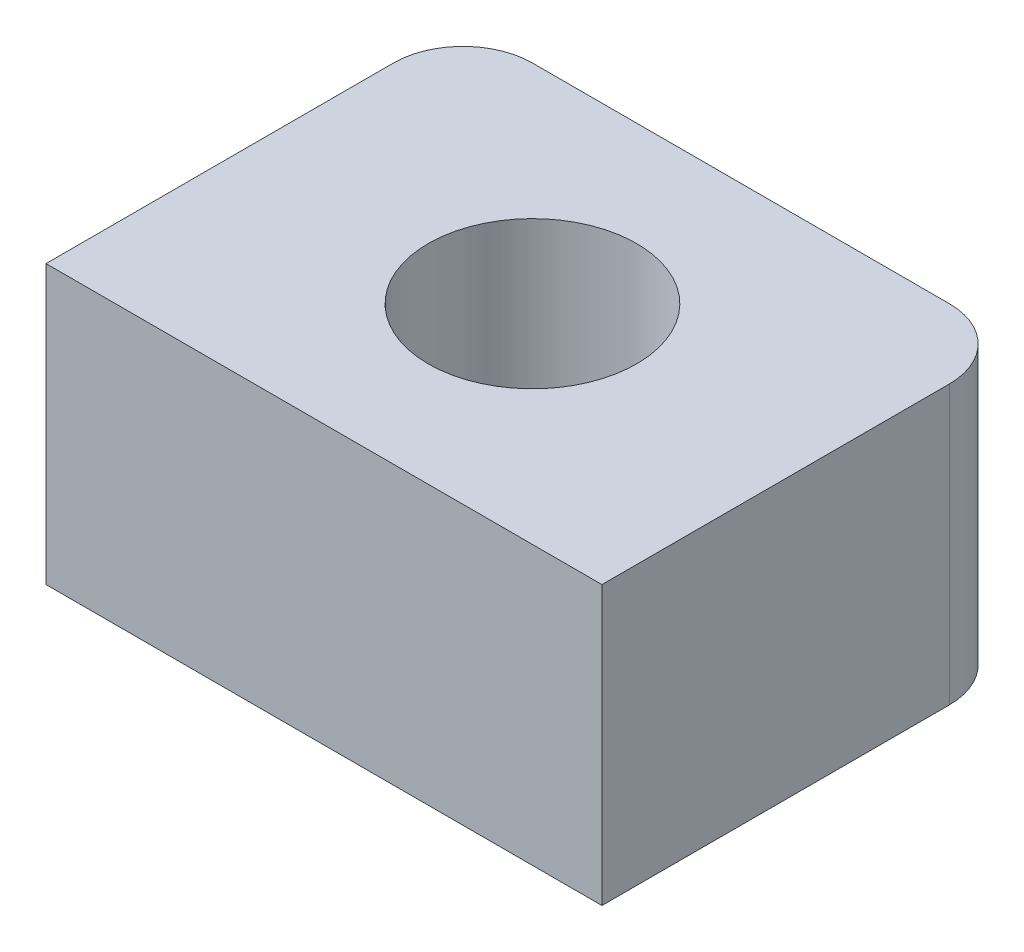
from build123d import *

# Parameters (mm, degrees)
SKETCH1_W           = 25.4
SKETCH1_H           = 19.05
BOSS_EXTRUDE1_DEPTH = 12.7
SKETCH2_R           = 4.7625
CUT_EXTRUDE1_DEPTH  = 35.195796525
FILLET1_R           = 3.175


with BuildPart() as part:
    # Sketch1 → Boss-Extrude1 (new body)
    with BuildSketch(Plane(origin=(0, 0, 0), x_dir=(1, 0, 0), z_dir=(0, 1, 0))):
        with Locations((12.7, 9.525)):
            Rectangle(SKETCH1_W, SKETCH1_H)
    extrude(amount=BOSS_EXTRUDE1_DEPTH)

    # Sketch2 → Cut-Extrude1 (cut, through all)
    with BuildSketch(Plane(origin=(0, 12.7, 0), x_dir=(1, 0, 0), z_dir=(0, 1, 0))):
        with Locations(Location((12.7, 9.525, 0), (0, 0, 270))):
            Circle(SKETCH2_R)
    extrude(amount=-CUT_EXTRUDE1_DEPTH, mode=Mode.SUBTRACT)

    # Fillet1
    fillet1_edges = [part.edges().sort_by_distance(p)[0] for p in [
        (0, 6.35, -19.05),
        (25.4, 6.35, -19.05),
    ]]
    fillet(fillet1_edges, radius=FILLET1_R)


solid = part.part
